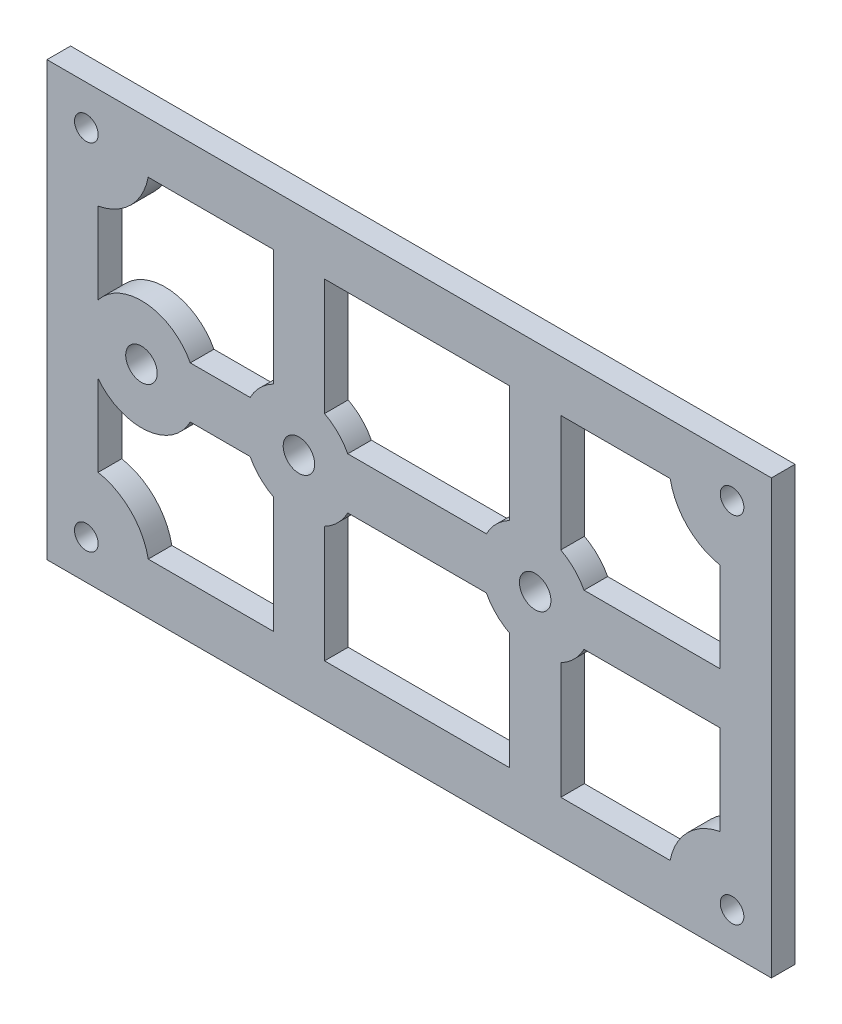
from build123d import *

# Parameters (mm, degrees)
SKETCH1_W           = 92
SKETCH1_H           = 55
SKETCH1_R           = 2
SKETCH1_R_2         = 1.5
BOSS_EXTRUDE1_DEPTH = 3


with BuildPart() as part:
    # Sketch1 → Boss-Extrude1 (new body)
    with BuildSketch(Plane.XY):
        Rectangle(SKETCH1_W, SKETCH1_H)
        with Locations((-34, 0)):
            Circle(SKETCH1_R, mode=Mode.SUBTRACT)
        with Locations((-14, 0)):
            Circle(SKETCH1_R, mode=Mode.SUBTRACT)
        with Locations((16, 0)):
            Circle(SKETCH1_R, mode=Mode.SUBTRACT)
        with Locations((-41, 22.5)):
            Circle(SKETCH1_R_2, mode=Mode.SUBTRACT)
        with Locations((41, 22.5)):
            Circle(SKETCH1_R_2, mode=Mode.SUBTRACT)
        with Locations((41, -22.5)):
            Circle(SKETCH1_R_2, mode=Mode.SUBTRACT)
        with Locations((-41, -22.5)):
            Circle(SKETCH1_R_2, mode=Mode.SUBTRACT)
        with BuildLine():
            Line((12.75, -21), (12.75, -6.199798384))
            ThreePointArc((12.75, -6.199798384), (11.050252532, -4.949747468), (9.800201616, -3.25))
            Line((9.800201616, -3.25), (-7.800201616, -3.25))
            ThreePointArc((-7.800201616, -3.25), (-9.050252532, -4.949747468), (-10.75, -6.199798384))
            Line((-10.75, -6.199798384), (-10.75, -21))
            Line((-10.75, -21), (12.75, -21))
        make_face(mode=Mode.SUBTRACT)
        with BuildLine():
            Line((-39.5, 4.330127019), (-39.5, 14.641883177))
            ThreePointArc((-39.5, 14.641883177), (-35.343145751, 16.843145751), (-33.141883177, 21))
            Line((-33.141883177, 21), (-17.25, 21))
            Line((-17.25, 21), (-17.25, 6.199798384))
            ThreePointArc((-17.25, 6.199798384), (-18.949747468, 4.949747468), (-20.199798384, 3.25))
            Line((-20.199798384, 3.25), (-27.800201616, 3.25))
            ThreePointArc((-27.800201616, 3.25), (-33.356495502, 6.970358812), (-39.5, 4.330127019))
        make_face(mode=Mode.SUBTRACT)
        with BuildLine():
            Line((-27.800201616, -3.25), (-20.199798384, -3.25))
            ThreePointArc((-20.199798384, -3.25), (-18.949747468, -4.949747468), (-17.25, -6.199798384))
            Line((-17.25, -6.199798384), (-17.25, -21))
            Line((-17.25, -21), (-33.141883177, -21))
            ThreePointArc((-33.141883177, -21), (-35.343145751, -16.843145751), (-39.5, -14.641883177))
            Line((-39.5, -14.641883177), (-39.5, -4.330127019))
            ThreePointArc((-39.5, -4.330127019), (-33.356495502, -6.970358812), (-27.800201616, -3.25))
        make_face(mode=Mode.SUBTRACT)
        with BuildLine():
            Line((19.25, -21), (19.25, -6.199798384))
            ThreePointArc((19.25, -6.199798384), (20.949747468, -4.949747468), (22.199798384, -3.25))
            Line((22.199798384, -3.25), (39.5, -3.25))
            Line((39.5, -3.25), (39.5, -14.641883177))
            ThreePointArc((39.5, -14.641883177), (35.343145751, -16.843145751), (33.141883177, -21))
            Line((33.141883177, -21), (19.25, -21))
        make_face(mode=Mode.SUBTRACT)
        with BuildLine():
            Line((39.5, 3.25), (39.5, 14.641883177))
            ThreePointArc((39.5, 14.641883177), (35.343145751, 16.843145751), (33.141883177, 21))
            Line((33.141883177, 21), (19.25, 21))
            Line((19.25, 21), (19.25, 6.199798384))
            ThreePointArc((19.25, 6.199798384), (20.949747468, 4.949747468), (22.199798384, 3.25))
            Line((22.199798384, 3.25), (39.5, 3.25))
        make_face(mode=Mode.SUBTRACT)
        with BuildLine():
            Line((-10.75, 21), (12.75, 21))
            Line((12.75, 21), (12.75, 6.199798384))
            ThreePointArc((12.75, 6.199798384), (11.050252532, 4.949747468), (9.800201616, 3.25))
            Line((9.800201616, 3.25), (-7.800201616, 3.25))
            ThreePointArc((-7.800201616, 3.25), (-9.050252532, 4.949747468), (-10.75, 6.199798384))
            Line((-10.75, 6.199798384), (-10.75, 21))
        make_face(mode=Mode.SUBTRACT)
    extrude(amount=BOSS_EXTRUDE1_DEPTH)


solid = part.part
